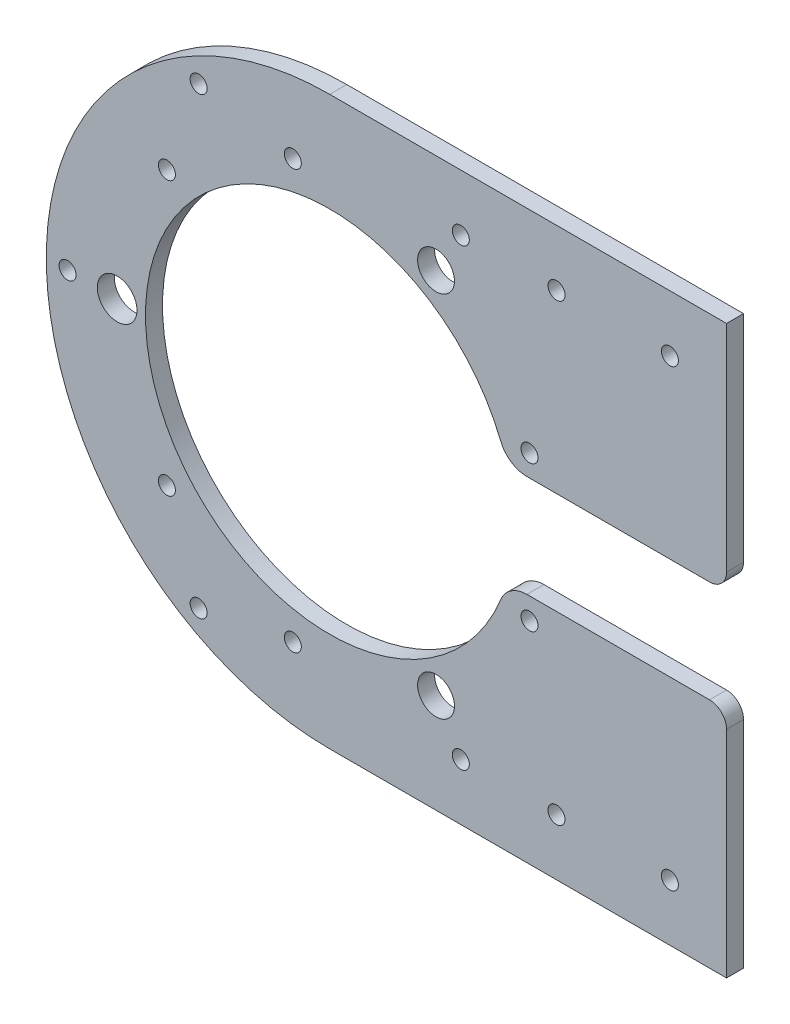
from build123d import *

# Parameters (mm, degrees)
SKETCH_1_R          = 1.5
SKETCH_1_R_2        = 32.5
EXTRUDE_1_DEPTH     = 3
SKETCH_2_R          = 3.25
SKETCH_2_R_2        = 3.5
SKETCH_2_W          = 16
SKETCH_2_H          = 18
CUT_EXTRUDE_2_DEPTH = 10
FILLET_2_R          = 5
FILLET_3_R          = 2
CUT_EXTRUDE_START   = -10
SKETCH_3_R          = 1.5
SKETCH_3_R_2        = 32.5
CUT_EXTRUDE_3_DEPTH = 10
SKETCH_5_R          = 1.5
CUT_EXTRUDE_4_DEPTH = 10
SKETCH_6_R          = 1.5
CUT_EXTRUDE_5_DEPTH = 404.124050386
SKETCH_7_R          = 1.5
CUT_EXTRUDE_6_DEPTH = 404.124050386
SKETCH_8_W          = 45.011761124
SKETCH_8_H          = 18
CUT_EXTRUDE_7_DEPTH = 10
FILLET_4_R          = 3


with BuildPart() as part:
    # 草图1 → 凸台-拉伸1 (new body)
    with BuildSketch(Plane.XY):
        with BuildLine():
            Line((-10, 50), (-350, 50))
            ThreePointArc((-350, 50), (-400, 0), (-350, -50))
            Line((-350, -50), (-10, -50))
            ThreePointArc((-10, -50), (40, 0), (-10, 50))
        make_face()
        with Locations((-387.5, 0)):
            Circle(SKETCH_1_R, mode=Mode.SUBTRACT)
        with Locations((-378.726666617, 24.104535363)):
            Circle(SKETCH_1_R, mode=Mode.SUBTRACT)
        with Locations((-356.511806663, 36.930290738)):
            Circle(SKETCH_1_R, mode=Mode.SUBTRACT)
        with Locations((-331.25, 32.475952642)):
            Circle(SKETCH_1_R, mode=Mode.SUBTRACT)
        with Locations((-314.761526721, 12.825755375)):
            Circle(SKETCH_1_R, mode=Mode.SUBTRACT)
        with Locations((-314.761526721, -12.825755375)):
            Circle(SKETCH_1_R, mode=Mode.SUBTRACT)
        with Locations((-331.25, -32.475952642)):
            Circle(SKETCH_1_R, mode=Mode.SUBTRACT)
        with Locations((-356.511806663, -36.930290738)):
            Circle(SKETCH_1_R, mode=Mode.SUBTRACT)
        with Locations((-378.726666617, -24.104535363)):
            Circle(SKETCH_1_R, mode=Mode.SUBTRACT)
        with Locations((-350, 0)):
            Circle(SKETCH_1_R_2, mode=Mode.SUBTRACT)
        with Locations((-10, 0)):
            Circle(SKETCH_1_R_2, mode=Mode.SUBTRACT)
        with Locations((18.726666617, -24.104535363)):
            Circle(SKETCH_1_R, mode=Mode.SUBTRACT)
        with Locations((-3.488193337, -36.930290738)):
            Circle(SKETCH_1_R, mode=Mode.SUBTRACT)
        with Locations((-28.75, -32.475952642)):
            Circle(SKETCH_1_R, mode=Mode.SUBTRACT)
        with Locations((-45.238473279, -12.825755375)):
            Circle(SKETCH_1_R, mode=Mode.SUBTRACT)
        with Locations((-45.238473279, 12.825755375)):
            Circle(SKETCH_1_R, mode=Mode.SUBTRACT)
        with Locations((-28.75, 32.475952642)):
            Circle(SKETCH_1_R, mode=Mode.SUBTRACT)
        with Locations((-3.488193337, 36.930290738)):
            Circle(SKETCH_1_R, mode=Mode.SUBTRACT)
        with Locations((18.726666617, 24.104535363)):
            Circle(SKETCH_1_R, mode=Mode.SUBTRACT)
        with Locations((27.5, 0)):
            Circle(SKETCH_1_R, mode=Mode.SUBTRACT)
    extrude(amount=EXTRUDE_1_DEPTH)

    # 草图2 → 切除-拉伸2 (cut)
    with BuildSketch(Plane.XY.offset(3)):
        with Locations((-331.250850225, 32.476443505)):
            Circle(SKETCH_2_R)
        with Locations((-387.499999987, -0.000981748)):
            Circle(SKETCH_2_R_2)
        with Locations((-331.249149788, -32.475461757)):
            Circle(SKETCH_2_R)
        with Locations((-317.5, 0)):
            Rectangle(SKETCH_2_W, SKETCH_2_H)
    extrude(amount=-CUT_EXTRUDE_2_DEPTH, mode=Mode.SUBTRACT)

    # 圆角2
    fillet_2_edges = [part.edges().sort_by_distance(p)[0] for p in [
        (-318.771007061, -9, 1.5),
        (-318.771007061, 9, 1.5),
    ]]
    fillet(fillet_2_edges, radius=FILLET_2_R)

    # 圆角3
    fillet_3_edges = [part.edges().sort_by_distance(p)[0] for p in [
        (-309.5, 9, 1.5),
        (-309.5, -9, 1.5),
    ]]
    fillet(fillet_3_edges, radius=FILLET_3_R)

    # 草图3 → 切除-拉伸3 (cut)
    with BuildSketch(Plane.XY.offset(3).offset(CUT_EXTRUDE_START)):
        with BuildLine():
            Line((-280, -50), (-180, -50))
            Line((-180, -50), (-10, -50))
            ThreePointArc((-10, -50), (40, 0), (-10, 50))
            Line((-10, 50), (-280, 50))
            Line((-280, 50), (-280, -50))
        make_face()
        with Locations((-28.75, -32.475952642)):
            Circle(SKETCH_3_R, mode=Mode.SUBTRACT)
        with Locations((-3.488193337, -36.930290738)):
            Circle(SKETCH_3_R, mode=Mode.SUBTRACT)
        with Locations((18.726666617, -24.104535363)):
            Circle(SKETCH_3_R, mode=Mode.SUBTRACT)
        with Locations((-45.238473279, -12.825755375)):
            Circle(SKETCH_3_R, mode=Mode.SUBTRACT)
        with Locations((-45.238473279, 12.825755375)):
            Circle(SKETCH_3_R, mode=Mode.SUBTRACT)
        with Locations((-10, 0)):
            Circle(SKETCH_3_R_2, mode=Mode.SUBTRACT)
        with Locations((27.5, 0)):
            Circle(SKETCH_3_R, mode=Mode.SUBTRACT)
        with Locations((-28.75, 32.475952642)):
            Circle(SKETCH_3_R, mode=Mode.SUBTRACT)
        with Locations((18.726666617, 24.104535363)):
            Circle(SKETCH_3_R, mode=Mode.SUBTRACT)
        with Locations((-3.488193337, 36.930290738)):
            Circle(SKETCH_3_R, mode=Mode.SUBTRACT)
    extrude(amount=CUT_EXTRUDE_3_DEPTH, mode=Mode.SUBTRACT)

    # 草图5 → 切除-拉伸4 (cut)
    with BuildSketch(Plane.XY.offset(3)):
        with Locations((-396.25, 0)):
            Circle(SKETCH_5_R)
    extrude(amount=-CUT_EXTRUDE_4_DEPTH, mode=Mode.SUBTRACT)

    # 草图6 → 切除-拉伸5 (cut, through all)
    with BuildSketch(Plane.XY.offset(3)):
        with Locations((-396.25, 0)):
            Circle(SKETCH_6_R)
        with Locations((-373.125, 40.053674925)):
            Circle(SKETCH_6_R)
        with Locations((-326.875, 40.053674925)):
            Circle(SKETCH_6_R)
        with Locations((-303.75, 0)):
            Circle(SKETCH_6_R)
        with Locations((-326.875, -40.053674925)):
            Circle(SKETCH_6_R)
        with Locations((-373.125, -40.053674925)):
            Circle(SKETCH_6_R)
    extrude(amount=-CUT_EXTRUDE_5_DEPTH, mode=Mode.SUBTRACT)

    # 草图7 → 切除-拉伸6 (cut, through all)
    with BuildSketch(Plane.XY.offset(3)):
        with Locations((-309.987078995, 40.056872182)):
            Circle(SKETCH_7_R)
        with Locations((-289.987080036, 40.050420343)):
            Circle(SKETCH_7_R)
        with Locations((-309.998951455, -40.050946012)):
            Circle(SKETCH_7_R)
        with Locations((-289.998951462, -40.050422413)):
            Circle(SKETCH_7_R)
    extrude(amount=-CUT_EXTRUDE_6_DEPTH, mode=Mode.SUBTRACT)

    # 草图8 → 切除-拉伸7 (cut)
    with BuildSketch(Plane.XY.offset(3)):
        with Locations((-290.849795651, 0)):
            Rectangle(SKETCH_8_W, SKETCH_8_H)
    extrude(amount=-CUT_EXTRUDE_7_DEPTH, mode=Mode.SUBTRACT)

    # 圆角4
    fillet_4_edges = [part.edges().sort_by_distance(p)[0] for p in [
        (-280, -9, 1.5),
        (-280, 9, 1.5),
    ]]
    fillet(fillet_4_edges, radius=FILLET_4_R)


solid = part.part
